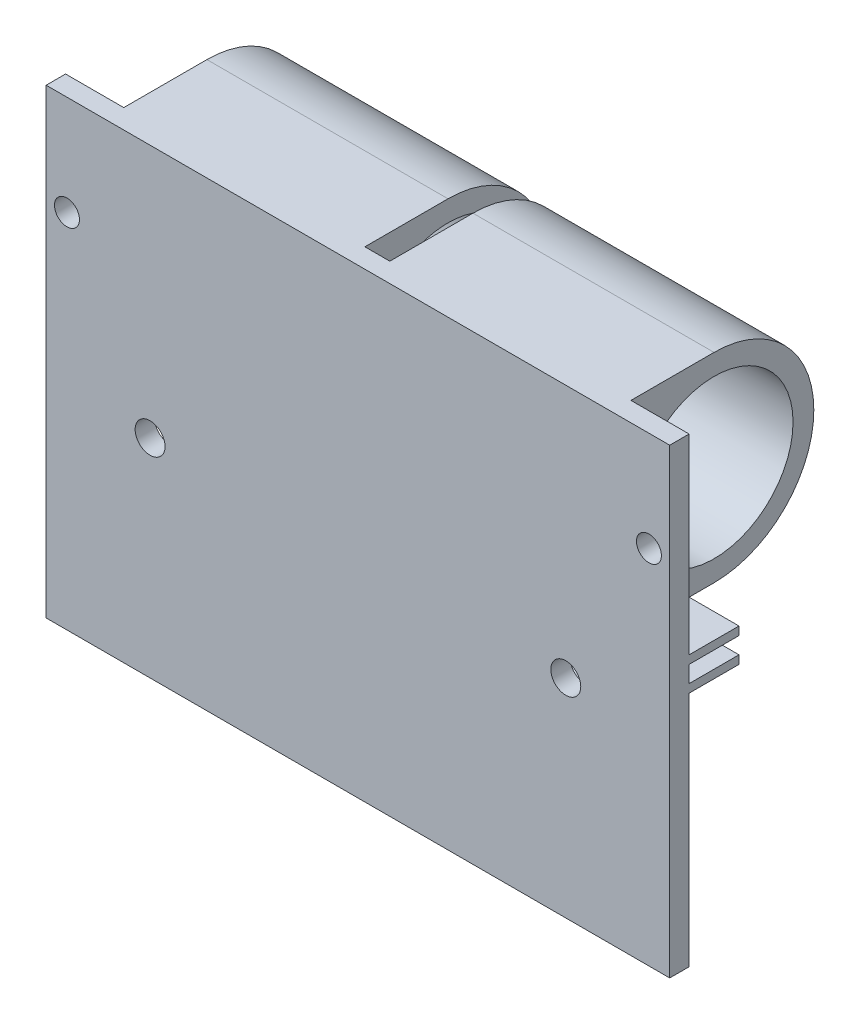
from build123d import *

# Parameters (mm, degrees)
SKETCH1_R              = 1.79994
SKETCH1_R_2            = 1.5
BOSS_EXTRUDE1_DEPTH    = 7
SKETCH2_W              = 75
SKETCH2_H              = 13.099999962
SKETCH2_R              = 2.6999438
SKETCH2_R_2            = 2.499995
SKETCH2_R_3            = 1.3498449
BOSS_EXTRUDE2_DEPTH    = 6.987999994
SKETCH2_3_R            = 2.6999438
SKETCH2_3_R_2          = 1.3498449
CUT_EXTRUDE1_DEPTH     = 2.5
SKETCH5_W              = 75
SKETCH5_H              = 13.099999962
CUT_EXTRUDE3_DEPTH     = 21.082
SKETCH6_W              = 75
SKETCH6_H              = 7
BOSS_EXTRUDE3_DEPTH    = 9.5
SKETCH8_W              = 75
SKETCH8_H              = 38.030205227
CUT_EXTRUDE4_DEPTH     = 4.666
SKETCH10_W             = 75
SKETCH10_H             = 2.334
BOSS_EXTRUDE5_DEPTH    = 25.000000038
SKETCH11_R             = 1.79994
CUT_EXTRUDE5_DEPTH     = 5
SKETCH15_W             = 44.653530321
SKETCH15_H             = 13.617301916
SKETCH15_W_2           = 11.728266088
SKETCH15_H_2           = 5.987537529
BOSS_EXTRUDE7_DEPTH    = 2.334
SKETCH16_R             = 9.5
BOSS_EXTRUDE9_DEPTH    = 29
SKETCH17_R             = 9.5
BOSS_EXTRUDE11_DEPTH   = 14.5
SKETCH18_W             = 6.99999997
SKETCH18_H             = 1
BOSS_EXTRUDE12_DEPTH   = 6
BOSS_EXTRUDE12_2_DEPTH = 6
SKETCH18_R             = 1.5
BOSS_EXTRUDE12_3_DEPTH = 6


with BuildPart() as part:
    # Sketch1 → Boss-Extrude1 (new body)
    with BuildSketch(Plane.XY):
        with BuildLine():
            Line((37.5, -10.5), (30, -10.5))
            ThreePointArc((30, -10.5), (25, -15.5), (20, -10.5))
            Line((20, -10.5), (5, -10.5))
            ThreePointArc((5, -10.5), (0, -15.5), (-5, -10.5))
            Line((-5, -10.5), (-20, -10.5))
            ThreePointArc((-20, -10.5), (-25, -15.5), (-30, -10.5))
            Line((-30, -10.5), (-37.5, -10.5))
            Line((-37.5, -10.5), (-37.5, 10.5))
            Line((-37.5, 10.5), (37.5, 10.5))
            Line((37.5, 10.5), (37.5, -10.5))
        make_face()
        with Locations((-25, -10.5)):
            Circle(SKETCH1_R, mode=Mode.SUBTRACT)
        with Locations((0, -10.5)):
            Circle(SKETCH1_R, mode=Mode.SUBTRACT)
        with Locations((25, -10.5)):
            Circle(SKETCH1_R, mode=Mode.SUBTRACT)
        with Locations((-35, 8)):
            Circle(SKETCH1_R_2, mode=Mode.SUBTRACT)
        with Locations(Location((-15, 8, 0), (0, 0, 180))):
            Circle(SKETCH1_R_2, mode=Mode.SUBTRACT)
        with Locations((-10, 8)):
            Circle(SKETCH1_R_2, mode=Mode.SUBTRACT)
        with Locations(Location((10, 8, 0), (0, 0, 180))):
            Circle(SKETCH1_R_2, mode=Mode.SUBTRACT)
        with Locations(Location((35, 8, 0), (0, 0, 180))):
            Circle(SKETCH1_R_2, mode=Mode.SUBTRACT)
        with Locations((15, 8)):
            Circle(SKETCH1_R_2, mode=Mode.SUBTRACT)
    extrude(amount=BOSS_EXTRUDE1_DEPTH)

    # Sketch2 → Boss-Extrude2 (add)
    # profile 1 of 7: a face of its own
    with BuildSketch(Plane(origin=(0, 2.24999999, 0), x_dir=(1, 0, 0), z_dir=(0, 1, 0))):
        with Locations((0, -13.549999981)):
            Rectangle(SKETCH2_W, SKETCH2_H)
        with Locations((31.0001404, -13.549999981)):
            Circle(SKETCH2_R, mode=Mode.SUBTRACT)
        with Locations((-31.0001404, -13.549999981)):
            Circle(SKETCH2_R, mode=Mode.SUBTRACT)
        with Locations(Location((-25, -13.549999981, 0), (0, 0, 180))):
            Circle(SKETCH2_R_2, mode=Mode.SUBTRACT)
        with Locations((-6.0001404, -13.549999981)):
            Circle(SKETCH2_R, mode=Mode.SUBTRACT)
        with Locations((6.0001404, -13.549999981)):
            Circle(SKETCH2_R, mode=Mode.SUBTRACT)
        with Locations(Location((0, -13.549999981, 0), (0, 0, 180))):
            Circle(SKETCH2_R_2, mode=Mode.SUBTRACT)
        with Locations((-18.9998596, -13.549999981)):
            Circle(SKETCH2_R, mode=Mode.SUBTRACT)
        with Locations(Location((25, -13.549999981, 0), (0, 0, 180))):
            Circle(SKETCH2_R_2, mode=Mode.SUBTRACT)
        with Locations((18.9998596, -13.549999981)):
            Circle(SKETCH2_R, mode=Mode.SUBTRACT)
    # profile 2 of 7: a face of its own
    with BuildSketch(Plane(origin=(0, 2.24999999, 0), x_dir=(1, 0, 0), z_dir=(0, 1, 0))):
        with Locations((-31.0001404, -13.549999981)):
            Circle(SKETCH2_R)
        with Locations(Location((-31.0001404, -13.549999981, 0), (0, 0, 180))):
            Circle(SKETCH2_R_3, mode=Mode.SUBTRACT)
    # profile 3 of 7: a face of its own
    with BuildSketch(Plane(origin=(0, 2.24999999, 0), x_dir=(1, 0, 0), z_dir=(0, 1, 0))):
        with Locations((-18.9998596, -13.549999981)):
            Circle(SKETCH2_R)
        with Locations(Location((-18.9998596, -13.549999981, 0), (0, 0, 180))):
            Circle(SKETCH2_R_3, mode=Mode.SUBTRACT)
    # profile 4 of 7: a face of its own
    with BuildSketch(Plane(origin=(0, 2.24999999, 0), x_dir=(1, 0, 0), z_dir=(0, 1, 0))):
        with Locations((-6.0001404, -13.549999981)):
            Circle(SKETCH2_R)
        with Locations(Location((-6.0001404, -13.549999981, 0), (0, 0, 180))):
            Circle(SKETCH2_R_3, mode=Mode.SUBTRACT)
    # profile 5 of 7: a face of its own
    with BuildSketch(Plane(origin=(0, 2.24999999, 0), x_dir=(1, 0, 0), z_dir=(0, 1, 0))):
        with Locations((6.0001404, -13.549999981)):
            Circle(SKETCH2_R)
        with Locations(Location((6.0001404, -13.549999981, 0), (0, 0, 180))):
            Circle(SKETCH2_R_3, mode=Mode.SUBTRACT)
    # profile 6 of 7: a face of its own
    with BuildSketch(Plane(origin=(0, 2.24999999, 0), x_dir=(1, 0, 0), z_dir=(0, 1, 0))):
        with Locations((18.9998596, -13.549999981)):
            Circle(SKETCH2_R)
        with Locations(Location((18.9998596, -13.549999981, 0), (0, 0, 180))):
            Circle(SKETCH2_R_3, mode=Mode.SUBTRACT)
    # profile 7 of 7: a face of its own
    with BuildSketch(Plane(origin=(0, 2.24999999, 0), x_dir=(1, 0, 0), z_dir=(0, 1, 0))):
        with Locations((31.0001404, -13.549999981)):
            Circle(SKETCH2_R)
        with Locations(Location((31.0001404, -13.549999981, 0), (0, 0, 180))):
            Circle(SKETCH2_R_3, mode=Mode.SUBTRACT)
    extrude(amount=-BOSS_EXTRUDE2_DEPTH)

    # Sketch2<3> → Cut-Extrude1 (cut)
    # profile 1 of 6: a face of its own
    with BuildSketch(Plane(origin=(0, 2.24999999, 0), x_dir=(1, 0, 0), z_dir=(0, 1, 0))):
        with Locations(Location((-31.0001404, -13.549999981, 0), (0, 0, 180))):
            Circle(SKETCH2_3_R)
        with Locations(Location((-31.0001404, -13.549999981, 0), (0, 0, 180))):
            Circle(SKETCH2_3_R_2, mode=Mode.SUBTRACT)
    # profile 2 of 6: a face of its own
    with BuildSketch(Plane(origin=(0, 2.24999999, 0), x_dir=(1, 0, 0), z_dir=(0, 1, 0))):
        with Locations(Location((-18.9998596, -13.549999981, 0), (0, 0, 180))):
            Circle(SKETCH2_3_R)
        with Locations(Location((-18.9998596, -13.549999981, 0), (0, 0, 180))):
            Circle(SKETCH2_3_R_2, mode=Mode.SUBTRACT)
    # profile 3 of 6: a face of its own
    with BuildSketch(Plane(origin=(0, 2.24999999, 0), x_dir=(1, 0, 0), z_dir=(0, 1, 0))):
        with Locations(Location((-6.0001404, -13.549999981, 0), (0, 0, 180))):
            Circle(SKETCH2_3_R)
        with Locations(Location((-6.0001404, -13.549999981, 0), (0, 0, 180))):
            Circle(SKETCH2_3_R_2, mode=Mode.SUBTRACT)
    # profile 4 of 6: a face of its own
    with BuildSketch(Plane(origin=(0, 2.24999999, 0), x_dir=(1, 0, 0), z_dir=(0, 1, 0))):
        with Locations(Location((6.0001404, -13.549999981, 0), (0, 0, 180))):
            Circle(SKETCH2_3_R)
        with Locations(Location((6.0001404, -13.549999981, 0), (0, 0, 180))):
            Circle(SKETCH2_3_R_2, mode=Mode.SUBTRACT)
    # profile 5 of 6: a face of its own
    with BuildSketch(Plane(origin=(0, 2.24999999, 0), x_dir=(1, 0, 0), z_dir=(0, 1, 0))):
        with Locations(Location((18.9998596, -13.549999981, 0), (0, 0, 180))):
            Circle(SKETCH2_3_R)
        with Locations(Location((18.9998596, -13.549999981, 0), (0, 0, 180))):
            Circle(SKETCH2_3_R_2, mode=Mode.SUBTRACT)
    # profile 6 of 6: a face of its own
    with BuildSketch(Plane(origin=(0, 2.24999999, 0), x_dir=(1, 0, 0), z_dir=(0, 1, 0))):
        with Locations(Location((31.0001404, -13.549999981, 0), (0, 0, 180))):
            Circle(SKETCH2_3_R)
        with Locations(Location((31.0001404, -13.549999981, 0), (0, 0, 180))):
            Circle(SKETCH2_3_R_2, mode=Mode.SUBTRACT)
    extrude(amount=-CUT_EXTRUDE1_DEPTH, mode=Mode.SUBTRACT)

    # Sketch5 → Cut-Extrude3 (cut)
    with BuildSketch(Plane(origin=(0, 2.24999999, 0), x_dir=(1, 0, 0), z_dir=(0, 1, 0))):
        with Locations((0, -13.549999981)):
            Rectangle(SKETCH5_W, SKETCH5_H)
    extrude(amount=-CUT_EXTRUDE3_DEPTH, mode=Mode.SUBTRACT)

    # Sketch6 → Boss-Extrude3 (add)
    with BuildSketch(Plane(origin=(0, 10.5, 0), x_dir=(1, 0, 0), z_dir=(0, 1, 0))):
        with Locations((0, -3.5)):
            Rectangle(SKETCH6_W, SKETCH6_H)
    extrude(amount=BOSS_EXTRUDE3_DEPTH)

    # Sketch8 → Cut-Extrude4 (cut)
    with BuildSketch(Plane(origin=(0, 0, 0), x_dir=(-1, 0, 0), z_dir=(0, 0, -1))):
        with Locations((0, 0.984897387)):
            Rectangle(SKETCH8_W, SKETCH8_H)
    extrude(amount=-CUT_EXTRUDE4_DEPTH, mode=Mode.SUBTRACT)

    # Sketch10 → Boss-Extrude5 (add)
    with BuildSketch(Plane(origin=(0, -35.500000038, 0), x_dir=(-1, 0, 0), z_dir=(0, -1, 0))):
        with Locations((0, -5.833)):
            Rectangle(SKETCH10_W, SKETCH10_H)
    extrude(amount=-BOSS_EXTRUDE5_DEPTH)

    # Sketch11 → Cut-Extrude5 (cut)
    with BuildSketch(Plane(origin=(0, 0, 4.666), x_dir=(-1, 0, 0), z_dir=(0, 0, -1))):
        with Locations((-25, -10.5)):
            Circle(SKETCH11_R)
        with Locations((0, -10.5)):
            Circle(SKETCH11_R)
        with Locations((25, -10.5)):
            Circle(SKETCH11_R)
    extrude(amount=-CUT_EXTRUDE5_DEPTH, mode=Mode.SUBTRACT)

    # Sketch15 → Boss-Extrude7 (add)
    with BuildSketch(Plane.XY.offset(7)):
        with Locations((1.804442165, 8.803924913)):
            Rectangle(SKETCH15_W, SKETCH15_H)
        with Locations((-1.501191344, -11.287680254)):
            Rectangle(SKETCH15_W_2, SKETCH15_H_2)
    extrude(amount=-BOSS_EXTRUDE7_DEPTH)


with BuildPart() as body_2:
    # Sketch16 → Boss-Extrude9 (new body)
    with BuildSketch(Plane(origin=(30.50000003, 0, 0), x_dir=(0, 0, -1), z_dir=(1, 0, 0))):
        with BuildLine():
            Line((-4.666, 9.5), (-4.666, 6.5))
            Line((-4.666, 6.5), (-4.666, -4))
            Line((-4.666, -4), (5.334, -4))
            ThreePointArc((5.334, -4), (17.334, 8), (5.334, 20))
            Line((5.334, 20), (-4.666, 20))
            Line((-4.666, 20), (-4.666, 9.5))
        make_face()
        with Locations((5.334, 8)):
            Circle(SKETCH16_R, mode=Mode.SUBTRACT)
    extrude(amount=-BOSS_EXTRUDE9_DEPTH)


with BuildPart() as body_3:
    # Mirror1: mirrored copy
    add(body_2.part.mirror(Plane(origin=(0, 0, 0), x_dir=(0, 0, 1), z_dir=(1, 0, 0))))

    # Combine1: union body 2, part
    add(body_2.part)
    add(part.part)

    # Sketch17 → Boss-Extrude11 (add, symmetric)
    with BuildSketch(Plane(origin=(0, 0, 0), x_dir=(0, 0, -1), z_dir=(1, 0, 0))):
        with BuildLine():
            Line((5.334, -35.500000038), (-4.666, -35.500000038))
            Line((-4.666, -35.500000038), (-4.666, -11.500000038))
            Line((-4.666, -11.500000038), (5.334, -11.500000038))
            ThreePointArc((5.334, -11.500000038), (17.334, -23.500000038), (5.334, -35.500000038))
        make_face()
        with Locations(Location((5.334, -23.500000038, 0), (0, 0, 180))):
            Circle(SKETCH17_R, mode=Mode.SUBTRACT)
    extrude(amount=BOSS_EXTRUDE11_DEPTH, both=True)


with BuildPart() as body_2_2:
    # Sketch18 → Boss-Extrude12 (new body)
    with BuildSketch(Plane(origin=(0, 0, 4.666), x_dir=(-1, 0, 0), z_dir=(0, 0, -1))):
        with Locations((-34.000000015, -3.5)):
            Rectangle(SKETCH18_W, SKETCH18_H)
    extrude(amount=BOSS_EXTRUDE12_DEPTH)


with BuildPart() as body_3_2:
    # Sketch18 → Boss-Extrude12 2 (new body)
    with BuildSketch(Plane(origin=(0, 0, 4.666), x_dir=(-1, 0, 0), z_dir=(0, 0, -1))):
        with BuildLine():
            Line((-16.114044259, -4), (-18.762606579, -4))
            ThreePointArc((-18.762606579, -4), (-16.636024525, -9.134023236), (-21.770047761, -7.007441182))
            Line((-21.770047761, -7.007441182), (-21.770047761, -6))
            Line((-21.770047761, -6), (-37.5, -6))
            Line((-37.5, -6), (-37.5, -7))
            Line((-37.5, -7), (-22.770047761, -7))
            Line((-22.770047761, -7), (-22.770047761, -7.007441182))
            ThreePointArc((-22.770047761, -7.007441182), (-17.112511564, -10.659395628), (-16.114044259, -4))
        make_face()
    extrude(amount=BOSS_EXTRUDE12_2_DEPTH)


with BuildPart() as body_4:
    # Sketch18 → Boss-Extrude12 3 (new body)
    with BuildSketch(Plane(origin=(0, 0, 4.666), x_dir=(-1, 0, 0), z_dir=(0, 0, -1))):
        with Locations((-18.762606579, -7.007441182)):
            Circle(SKETCH18_R)
    extrude(amount=BOSS_EXTRUDE12_3_DEPTH)


with BuildPart() as body_5:
    # Mirror2: mirrored copy
    add(body_3_2.part.mirror(Plane(origin=(0, 0, 0), x_dir=(0, 0, 1), z_dir=(1, 0, 0))))


with BuildPart() as body_6:
    # Mirror2 2: mirrored copy
    add(body_4.part.mirror(Plane(origin=(0, 0, 0), x_dir=(0, 0, 1), z_dir=(1, 0, 0))))


with BuildPart() as body_7:
    # Mirror2 3: mirrored copy
    add(body_2_2.part.mirror(Plane(origin=(0, 0, 0), x_dir=(0, 0, 1), z_dir=(1, 0, 0))))


with BuildPart() as body_5_1:
    add(body_5.part)

    # Combine2: union body 7, body 2 2, body 4, body 3 2, body 3, body 6
    add(body_7.part)
    add(body_2_2.part)
    add(body_4.part)
    add(body_3_2.part)
    add(body_3.part)
    add(body_6.part)


solid = body_5_1.part
